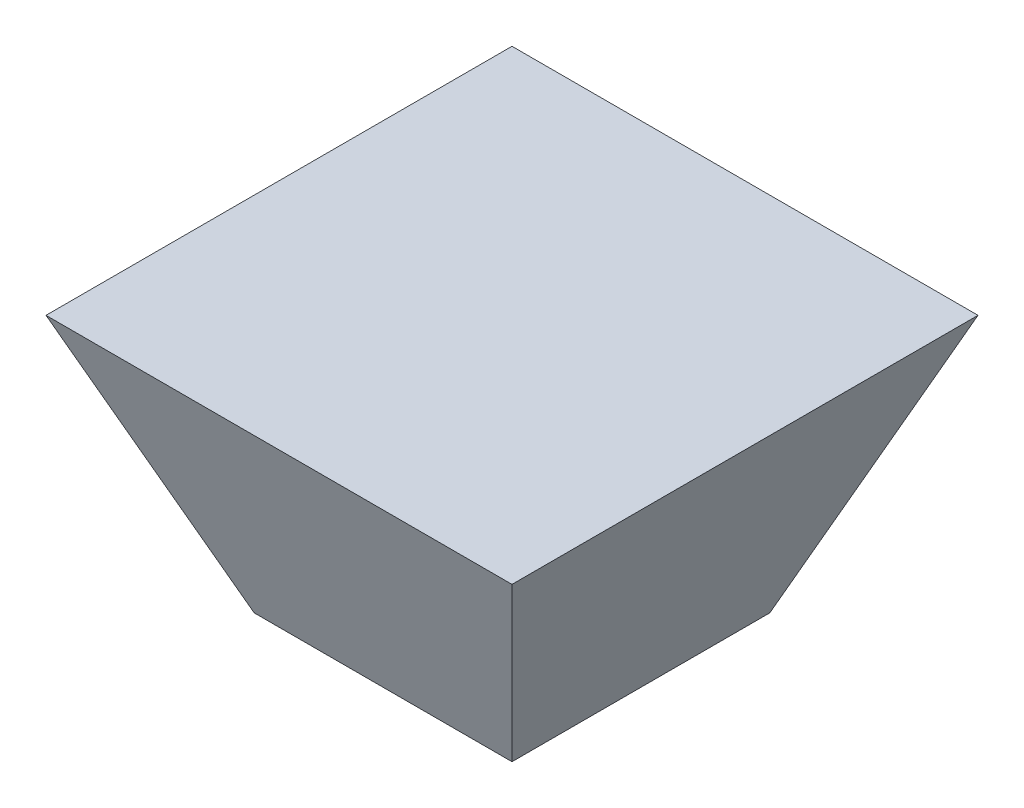
from build123d import *

# Parameters (mm, degrees)
SKETCH1_W           = 112.7
SKETCH1_H           = 112.7
BOSS_EXTRUDE1_DEPTH = 112.7
BOSS_EXTRUDE1_DRAFT = -22


with BuildPart() as part:
    # Sketch1 → Boss-Extrude1 (with draft: the straight prism first)
    with BuildSketch(Plane(origin=(0, 0, 0), x_dir=(1, 0, 0), z_dir=(0, 1, 0))):
        Rectangle(SKETCH1_W, SKETCH1_H)
    extrude(amount=BOSS_EXTRUDE1_DEPTH)
    # Boss-Extrude1: the draft: its side faces are tilted about the plane it starts from
    boss_extrude1_sides = [part.faces().sort_by_distance(p)[0] for p in [
        (56.35, 56.35, 0),
        (0, 56.35, -56.35),
        (-56.35, 56.35, 0),
        (0, 56.35, 56.35),
    ]]
    draft(boss_extrude1_sides, Plane(origin=(0, 0, 0), x_dir=(1, 0, 0), z_dir=(0, 1, 0)), BOSS_EXTRUDE1_DRAFT)


solid = part.part
